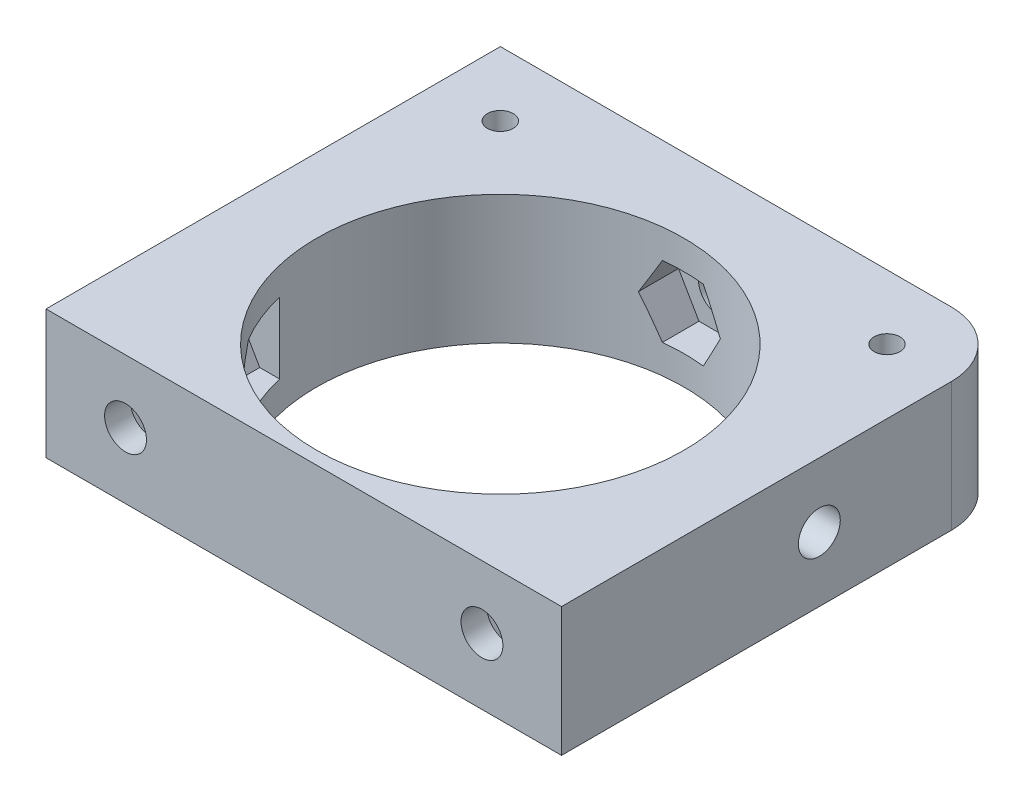
from build123d import *
from build123d.topology import SkipClean

# Parameters (mm, degrees)
CROQUIS1_R                              = 15.25
CROQUIS1_R_2                            = 2.125
SOPORTE_CAJA_REDUCTORA_DEPTH            = 20
CROQUIS3_R                              = 2.125
CORTAR_EXTRUIR1_DEPTH                   = 51.423828692
REDONDEO1_R                             = 5
BOSS_EXTRUDE1_START                     = -20
BOSS_EXTRUDE1_DEPTH                     = 20
CUT_EXTRUDE1_REACH                      = 55.852
SKETCH2_R                               = 1.625
CUT_EXTRUDE2_DEPTH                      = 2
SKETCH4_R                               = 1.625
CUT_EXTRUDE3_DEPTH                      = 63.291652731
CUT_EXTRUDE4_START                      = -4.5
CUT_EXTRUDE4_DEPTH                      = 2
CROQUIS6_W                              = 4.75
CROQUIS6_H                              = 4.75
CORTAR_EXTRUIR17_DEPTH                  = 42.231056256
CROQUIS7_W                              = 60
CROQUIS7_H                              = 20
CORTAR_EXTRUIR18_DEPTH                  = 51.423828692
SALIENTE_EXTRUIR2_DEPTH                 = 49
SOPORTE_START                           = -15
SOPORTE_MOTOR_DEPTH                     = 15
CROQUIS12_R                             = 2.125
AGUJEROS_DE_SUJECION_A_BASE_DEPTH       = 84.087679592
TUERCA_START                            = -4
TUERCA_AGUJERO_DE_SUJECION_A_BASE_DEPTH = 10
SALIENTE_EXTRUIR4_DEPTH                 = 15
CORTAR_EXTRUIR19_DEPTH                  = 25
CROQUIS14_W                             = 50
CROQUIS14_H                             = 118
CORTAR_EXTRUIR22_DEPTH                  = 146.556045907
CROQUIS15_W                             = 10
CROQUIS15_H                             = 7
CORTAR_EXTRUIR23_DEPTH                  = 42.231056256
CORTAR_EXTRUIR24_DEPTH                  = 42.231056256
CROQUIS18_W                             = 40
CROQUIS18_H                             = 10
CORTAR_EXTRUIR25_DEPTH                  = 44.27311521
SALIENTE_EXTRUIR5_DEPTH                 = 10
CROQUIS20_R                             = 1
CORTAR_EXTRUIR26_DEPTH                  = 49.229270158
CORTAR_EXTRUIR27_REACH                  = 62.959
CORTAR_EXTRUIR27_END_RADIUS             = 15.25
CROQUIS21_R                             = 1.625
CROQUIS22_R                             = 2.125
CROQUIS22_R_2                           = 1
SALIENTE_EXTRUIR6_DEPTH                 = 10
CROQUIS23_R                             = 1.625
CORTAR_EXTRUIR28_DEPTH                  = 52.269508521
CORTAR_EXTRUIR29_START                  = -3
CORTAR_EXTRUIR29_DEPTH                  = 10
SALIENTE_EXTRUIR7_DEPTH                 = 10
CORTAR_EXTRUIR30_REACH                  = 72.235
CROQUIS27_R                             = 1.625
CORTAR_EXTRUIR31_REACH                  = 75.235
CORTAR_EXTRUIR31_START                  = -3
CORTAR_EXTRUIR32_REACH                  = 58.612
CROQUIS29_R                             = 1.625
CORTAR_EXTRUIR33_REACH                  = 61.112
CORTAR_EXTRUIR33_START                  = -2.5
CORTAR_EXTRUIR34_DEPTH                  = 63.931555098
CORTAR_EXTRUIR34_DEPTH_BACK             = 63.931555098
CROQUIS35_W                             = 13.305418987
CROQUIS35_H                             = 6.826864192
CORTAR_EXTRUIR35_START                  = -3
CORTAR_EXTRUIR35_DEPTH                  = 10
SALIENTE_EXTRUIR8_DEPTH                 = 10
SALIENTE_EXTRUIR9_DEPTH                 = 13
SALIENTE_EXTRUIR10_DEPTH                = 3
CORTAR_EXTRUIR36_DEPTH                  = 80.887064817
CORTAR_EXTRUIR36_DEPTH_BACK             = 80.887064817
CROQUIS40_W                             = 106.583537839
CROQUIS40_H                             = 47.391515964
CORTAR_EXTRUIR37_DEPTH                  = 67.2524009
CORTAR_EXTRUIR37_DEPTH_BACK             = 67.2524009
CORTAR_EXTRUIR38_DEPTH                  = 79.704784639
CORTAR_EXTRUIR38_DEPTH_BACK             = 79.704784639
SALIENTE_EXTRUIR11_DEPTH                = 10
CORTAR_EXTRUIR39_DEPTH                  = 63.9908649
CROQUIS45_W                             = 31.470301378
CROQUIS45_H                             = 10
CROQUIS45_R                             = 1.625
SALIENTE_EXTRUIR12_DEPTH                = 2.5
SALIENTE_EXTRUIR13_DEPTH                = 10
CORTAR_EXTRUIR40_START                  = -2
CROQUIS47_R                             = 1.625
CORTAR_EXTRUIR40_DEPTH                  = 10
CORTAR_EXTRUIR41_START                  = -12
CROQUIS48_R                             = 1.625
CORTAR_EXTRUIR41_DEPTH                  = 12
CORTAR_EXTRUIR42_DEPTH                  = 52.795622989
CORTAR_EXTRUIR42_DEPTH_BACK             = 52.795622989
CROQUIS49_W                             = 34.796066513
CROQUIS49_H                             = 42.211026982
CROQUIS51_R                             = 15.25
CROQUIS51_R_2                           = 14.25
SALIENTE_EXTRUIR14_DEPTH                = 10
CORTAR_EXTRUIR43_DEPTH                  = 10
CORTAR_EXTRUIR44_DEPTH                  = 10
CORTAR_EXTRUIR45_DEPTH                  = 10
SALIENTE_EXTRUIR15_DEPTH                = 10


with BuildPart() as part:
    # Croquis1 → Soporte caja reductora (new body)
    with BuildSketch(Plane(origin=(0, 0, 0), x_dir=(1, 0, 0), z_dir=(0, 1, 0))):
        Polygon((-30, -15.25), (-20, -15.25), (-20, -20), (20, -20), (20, -15.25), (30, -15.25), (30, -7.25), (20, -4.25), (20, 20), (-20, 20), (-20, -4.25), (-30, -7.25), align=None)
        with Locations(Location((0, 0, 0), (0, 0, 270))):
            Circle(CROQUIS1_R, mode=Mode.SUBTRACT)
        with Locations(Location((-15, 15, 0), (0, 0, 270))):
            Circle(CROQUIS1_R_2, mode=Mode.SUBTRACT)
        with Locations(Location((15, 15, 0), (0, 0, 270))):
            Circle(CROQUIS1_R_2, mode=Mode.SUBTRACT)
    extrude(amount=-SOPORTE_CAJA_REDUCTORA_DEPTH)

    # Croquis3 → Cortar-Extruir1 (cut, through all)
    with BuildSketch(Plane.XY.offset(15.25)):
        with Locations((-23.5, -10)):
            Circle(CROQUIS3_R)
        with Locations((23.5, -10)):
            Circle(CROQUIS3_R)
    extrude(amount=-CORTAR_EXTRUIR1_DEPTH, mode=Mode.SUBTRACT)

    # Redondeo1
    redondeo1_edges = [part.edges().sort_by_distance(p)[0] for p in [
        (-20, -10, -20),
        (20, -10, -20),
    ]]
    fillet(redondeo1_edges, radius=REDONDEO1_R)

    # Sketch1 → Boss-Extrude1 (add)
    with BuildSketch(Plane(origin=(0, 0, 0), x_dir=(1, 0, 0), z_dir=(0, 1, 0)).offset(BOSS_EXTRUDE1_START)):
        with BuildLine():
            Line((25.5, 15), (20, 15))
            ThreePointArc((20, 15), (18.535533906, 18.535533906), (15, 20))
            Line((15, 20), (30, 20))
            Line((30, 20), (30, 8))
            Line((30, 8), (25.5, 8))
            Line((25.5, 8), (25.5, 15))
        make_face()
    extrude(amount=BOSS_EXTRUDE1_DEPTH)

    # Sketch2 → Cut-Extrude1 (cut, up to next)
    with BuildSketch(Plane(origin=(0, 0, -20), x_dir=(-1, 0, 0), z_dir=(0, 0, -1)), mode=Mode.PRIVATE) as cut_extrude1_sk1:
        with Locations((-22.75, -10)):
            Circle(SKETCH2_R)
    cut_extrude1_tool1 = extrude(cut_extrude1_sk1.sketch, amount=-CUT_EXTRUDE1_REACH, mode=Mode.PRIVATE) & part.part
    add(cut_extrude1_tool1.solids().sort_by_distance((22.75, -10, -20))[0], mode=Mode.SUBTRACT)

    # Sketch3 → Cut-Extrude2 (cut)
    with BuildSketch(Plane.XY.offset(-15)):
        Polygon((20, -11.58771324), (22.75, -13.175426481), (25.5, -11.58771324), (25.5, -8.41228676), (22.75, -6.824573519), (20, -8.41228676), align=None)
    extrude(amount=-CUT_EXTRUDE2_DEPTH, mode=Mode.SUBTRACT)

    # Sketch4 → Cut-Extrude3 (cut, through all)
    with BuildSketch(Plane.ZY.offset(-25.5)):
        with Locations((-12.25, -10)):
            Circle(SKETCH4_R)
    extrude(amount=-CUT_EXTRUDE3_DEPTH, mode=Mode.SUBTRACT)

    # Sketch5 → Cut-Extrude4 (cut)
    with BuildSketch(Plane(origin=(30, 0, 0), x_dir=(0, 0, -1), z_dir=(1, 0, 0)).offset(CUT_EXTRUDE4_START)):
        Polygon((15, -11.58771324), (15, -8.41228676), (12.25, -6.824573519), (9.5, -8.41228676), (9.5, -11.58771324), (12.25, -13.175426481), align=None)
    extrude(amount=CUT_EXTRUDE4_DEPTH, mode=Mode.SUBTRACT)

    # Croquis6 → Cortar-Extruir17 (cut, through all)
    with BuildSketch(Plane(origin=(0, 0, 0), x_dir=(1, 0, 0), z_dir=(0, 1, 0))):
        Polygon((0, -15.25), (-15.25, -15.25), (-15.25, -20), (15.25, -20), (15.25, -15.25), align=None)
        with Locations((-17.625, -17.625)):
            Rectangle(CROQUIS6_W, CROQUIS6_H)
        with BuildLine():
            ThreePointArc((0, -15.25), (-10.783378413, -10.783378413), (-15.25, 0))
            Line((-15.25, 0), (-15.25, -15.25))
            Line((-15.25, -15.25), (0, -15.25))
        make_face()
        with BuildLine():
            Line((15.25, -15.25), (15.25, 0))
            ThreePointArc((15.25, 0), (10.783378413, -10.783378413), (0, -15.25))
            Line((0, -15.25), (15.25, -15.25))
        make_face()
        with Locations((17.625, -17.625)):
            Rectangle(CROQUIS6_W, CROQUIS6_H)
    extrude(amount=-CORTAR_EXTRUIR17_DEPTH, mode=Mode.SUBTRACT)


with BuildPart() as body_2:
    # Simetría1: mirrored copy
    add(part.part.mirror(Plane.ZX))

    # Croquis8 → Saliente-Extruir2 (add)
    with SkipClean():  # the faces are left unmerged after this step: merging them gives an invalid solid
        with BuildSketch(Plane(origin=(0, 20, 0), x_dir=(1, 0, 0), z_dir=(0, 1, 0))):
            with BuildLine():
                Line((-12.664515522, 20), (-11.040489496, 13.939052358))
                Line((-11.040489496, 13.939052358), (-10.315162126, 11.232093763))
                ThreePointArc((-10.315162126, 11.232093763), (0, 15.25), (10.315162126, 11.232093763))
                Line((10.315162126, 11.232093763), (10.817418481, 13.87928066))
                Line((10.817418481, 13.87928066), (11.978715476, 20))
                Line((11.978715476, 20), (-12.664515522, 20))
            make_face()
        extrude(amount=SALIENTE_EXTRUIR2_DEPTH)

    # Croquis9 → Soporte motor (add)
    with SkipClean():  # the faces are left unmerged after this step: merging them gives an invalid solid
        with BuildSketch(Plane(origin=(0, 69, 0), x_dir=(1, 0, 0), z_dir=(0, 1, 0)).offset(SOPORTE_START)):
            with BuildLine():
                Line((-20, 15), (-20, -4.25))
                Line((-20, -4.25), (-30, -7.25))
                Line((-30, -7.25), (-30, -15.25))
                Line((-30, -15.25), (0, -15.25))
                Line((0, -15.25), (0, -14.75))
                ThreePointArc((0, -14.75), (-10.429825023, 10.429825023), (14.75, 0))
                Line((14.75, 0), (20, 0))
                Line((20, 0), (20, 13.936837101))
                Line((20, 13.936837101), (12.664515522, 20))
                Line((12.664515522, 20), (-15, 20))
                ThreePointArc((-15, 20), (-18.535533906, 18.535533906), (-20, 15))
            make_face()
        extrude(amount=-SOPORTE_MOTOR_DEPTH)

    # Croquis12 → Agujeros de sujecion a base (cut, through all)
    with SkipClean():  # the faces are left unmerged after this step: merging them gives an invalid solid
        with BuildSketch(Plane.XY.offset(15.25)):
            with Locations((-23.5, 46.5)):
                Circle(CROQUIS12_R)
        extrude(amount=-AGUJEROS_DE_SUJECION_A_BASE_DEPTH, mode=Mode.SUBTRACT)

    # Croquis13 → Tuerca Agujero de sujecion a base (cut)
    with SkipClean():  # the faces are left unmerged after this step: merging them gives an invalid solid
        with BuildSketch(Plane.XY.offset(15.25).offset(TUERCA_START)):
            Polygon((-20, 44.479274058), (-20, 48.520725942), (-23.5, 50.541451884), (-27, 48.520725942), (-27, 44.479274058), (-23.5, 42.458548116), align=None)
        extrude(amount=-TUERCA_AGUJERO_DE_SUJECION_A_BASE_DEPTH, mode=Mode.SUBTRACT)

    # Croquis10 → Saliente-Extruir4 (add)
    with SkipClean():  # the faces are left unmerged after this step: merging them gives an invalid solid
        with BuildSketch(Plane(origin=(0, 69, 0), x_dir=(1, 0, 0), z_dir=(0, 1, 0))):
            with BuildLine():
                ThreePointArc((10.315162126, 11.232093763), (0, 15.25), (-10.315162126, 11.232093763))
                Line((-10.315162126, 11.232093763), (-10.16850369, 10.684757026))
                ThreePointArc((-10.16850369, 10.684757026), (0, 14.75), (10.16850369, 10.684757026))
                Line((10.16850369, 10.684757026), (10.315162126, 11.232093763))
            make_face()
        extrude(amount=-SALIENTE_EXTRUIR4_DEPTH)

    # Croquis11 → Cortar-Extruir19 (cut)
    with SkipClean():  # the faces are left unmerged after this step: merging them gives an invalid solid
        with BuildSketch(Plane.XZ):
            with BuildLine():
                Line((15.25, 4.25), (20, 4.25))
                Line((20, 4.25), (21.972856468, 4.84185694))
                ThreePointArc((21.972856468, 4.84185694), (19.948931102, 10.40625523), (16.543503257, 15.25))
                Line((16.543503257, 15.25), (15.25, 15.25))
                Line((15.25, 15.25), (15.25, 4.25))
            make_face()
            with BuildLine():
                Line((21.972856468, 4.84185694), (30, 7.25))
                Line((30, 7.25), (30, 15.25))
                Line((30, 15.25), (16.543503257, 15.25))
                ThreePointArc((16.543503257, 15.25), (19.948931102, 10.40625523), (21.972856468, 4.84185694))
            make_face()
            with BuildLine():
                ThreePointArc((20, -15), (18.535533906, -18.535533906), (15, -20))
                Line((15, -20), (30, -20))
                Line((30, -20), (30, -8))
                Line((30, -8), (25.5, -8))
                Line((25.5, -8), (25.5, -15))
                Line((25.5, -15), (20, -15))
            make_face()
        extrude(amount=-CORTAR_EXTRUIR19_DEPTH, mode=Mode.SUBTRACT)

    # Simetría2: body 2 across face


with BuildPart() as part_1:
    add(part.part)

    # Croquis7 → Cortar-Extruir18 (cut, through all)
    with BuildSketch(Plane(origin=(0, 0, -20), x_dir=(-1, 0, 0), z_dir=(0, 0, -1))):
        with Locations((0, -10)):
            Rectangle(CROQUIS7_W, CROQUIS7_H)
    extrude(amount=-CORTAR_EXTRUIR18_DEPTH, mode=Mode.SUBTRACT)


with BuildPart() as body_2_1:
    with SkipClean():  # the faces are left unmerged after this step: merging them gives an invalid solid
        add(body_2.part)
        add(body_2.part.mirror(Plane(origin=(-0.247462117, 69, -16.905803936), x_dir=(0, 0, 1), z_dir=(0, 1, 0))))

    # Croquis14 → Cortar-Extruir22 (cut, through all)
    with BuildSketch(Plane.XY.offset(15.25)):
        with Locations((-5, 79)):
            Rectangle(CROQUIS14_W, CROQUIS14_H)
    extrude(amount=-CORTAR_EXTRUIR22_DEPTH, mode=Mode.SUBTRACT)

    # Croquis15 → Cortar-Extruir23 (cut, through all)
    with BuildSketch(Plane.XZ):
        with Locations((-25, 7.75)):
            Rectangle(CROQUIS15_W, CROQUIS15_H)
    extrude(amount=-CORTAR_EXTRUIR23_DEPTH, mode=Mode.SUBTRACT)

    # Croquis16 → Cortar-Extruir24 (cut, through all)
    with BuildSketch(Plane.XZ):
        Polygon((-30, 15.25), (-15.25, 15.25), (-15.25, 12.75), (-20, 12.75), (-20, 11.25), (-30, 11.25), (-30, 12.75), align=None)
    extrude(amount=-CORTAR_EXTRUIR24_DEPTH, mode=Mode.SUBTRACT)

    # Croquis18 → Cortar-Extruir25 (cut, through all)
    with BuildSketch(Plane(origin=(0, 0, -20), x_dir=(-1, 0, 0), z_dir=(0, 0, -1))):
        with Locations((0, 5)):
            Rectangle(CROQUIS18_W, CROQUIS18_H)
    extrude(amount=-CORTAR_EXTRUIR25_DEPTH, mode=Mode.SUBTRACT)

    # Croquis19 → Saliente-Extruir5 (add)
    with BuildSketch(Plane(origin=(0, 20, 0), x_dir=(1, 0, 0), z_dir=(0, 1, 0))):
        Polygon((-20, -12.75), (-34, -12.75), (-34, -7.75), (-24, -7.75), (-20, -3.75), align=None)
    extrude(amount=-SALIENTE_EXTRUIR5_DEPTH)

    # Croquis20 → Cortar-Extruir26 (cut, through all)
    with BuildSketch(Plane(origin=(0, 0, 7.75), x_dir=(-1, 0, 0), z_dir=(0, 0, -1))):
        with Locations((29, 15)):
            Circle(CROQUIS20_R)
    extrude(amount=-CORTAR_EXTRUIR26_DEPTH, mode=Mode.SUBTRACT)

    # Cortar-Extruir27: up to this cylinder (the profile starts outside it)
    cortar_extruir27_end = Plane(origin=(0, 15, 0), z_dir=(0, -1, 0)) * Cylinder(CORTAR_EXTRUIR27_END_RADIUS, 157.418, mode=Mode.PRIVATE)
    # Croquis21 → Cortar-Extruir27 (cut, up to the surface)
    with BuildSketch(Plane(origin=(20, 0, 0), x_dir=(0, 0, -1), z_dir=(1, 0, 0)), mode=Mode.PRIVATE) as cortar_extruir27_sk1:
        with Locations((4.75, 15)):
            Circle(CROQUIS21_R)
    cortar_extruir27_tool1 = extrude(cortar_extruir27_sk1.sketch, amount=-CORTAR_EXTRUIR27_REACH, mode=Mode.PRIVATE) - cortar_extruir27_end
    add(cortar_extruir27_tool1.solids().sort_by_distance((20, 15, -4.75))[0], mode=Mode.SUBTRACT)

    # Croquis22 → Saliente-Extruir6 (add)
    # profile 1 of 2: a face of its own
    with BuildSketch(Plane.XZ.offset(-10)):
        with Locations((-15, -15)):
            Circle(CROQUIS22_R)
        with Locations(Location((-15, -15, 0), (0, 0, 270))):
            Circle(CROQUIS22_R_2, mode=Mode.SUBTRACT)
    # profile 2 of 2: a face of its own
    with BuildSketch(Plane.XZ.offset(-10)):
        with Locations((15, -15)):
            Circle(CROQUIS22_R)
        with Locations(Location((15, -15, 0), (0, 0, 270))):
            Circle(CROQUIS22_R_2, mode=Mode.SUBTRACT)
    extrude(amount=-SALIENTE_EXTRUIR6_DEPTH)

    # Croquis23 → Cortar-Extruir28 (cut, through all)
    with BuildSketch(Plane(origin=(0, 0, -20), x_dir=(-1, 0, 0), z_dir=(0, 0, -1))):
        with Locations((0, 15)):
            Circle(CROQUIS23_R)
    extrude(amount=-CORTAR_EXTRUIR28_DEPTH, mode=Mode.SUBTRACT)

    # Croquis24 → Cortar-Extruir29 (cut)
    with BuildSketch(Plane(origin=(0, 0, -20), x_dir=(-1, 0, 0), z_dir=(0, 0, -1)).offset(CORTAR_EXTRUIR29_START)):
        Polygon((1.58771324, 12.25), (3.175426481, 15), (1.58771324, 17.75), (-1.58771324, 17.75), (-3.175426481, 15), (-1.58771324, 12.25), align=None)
    extrude(amount=-CORTAR_EXTRUIR29_DEPTH, mode=Mode.SUBTRACT)

    # Croquis26 → Saliente-Extruir7 (add)
    with BuildSketch(Plane.XZ.offset(-10)):
        Polygon((-34, 7.75), (-34, 12.75), (-58.825, 12.75), (-39.160527763, -4.104491148), (-20, -4.104491148), (-20, -0.104491148), (-35.732113118, -0.104491148), (-29, 7.75), align=None)
        Polygon((-34.268209086, 7.75), (-39.594516123, 1.535690951), (-46.844874897, 7.75), align=None, mode=Mode.SUBTRACT)
    extrude(amount=-SALIENTE_EXTRUIR7_DEPTH)

    # Croquis27 → Cortar-Extruir30 (cut, up to next)
    with BuildSketch(Plane.XY.offset(12.75), mode=Mode.PRIVATE) as cortar_extruir30_sk1:
        with Locations((-40.544874897, 15)):
            Circle(CROQUIS27_R)
    cortar_extruir30_tool1 = extrude(cortar_extruir30_sk1.sketch, amount=-CORTAR_EXTRUIR30_REACH, mode=Mode.PRIVATE) & body_2_1.part
    # Croquis27 → Cortar-Extruir30 (cut, up to next)
    with BuildSketch(Plane.XY.offset(12.75), mode=Mode.PRIVATE) as cortar_extruir30_sk2:
        with Locations((-29, 15)):
            Circle(CROQUIS27_R)
    cortar_extruir30_tool2 = extrude(cortar_extruir30_sk2.sketch, amount=-CORTAR_EXTRUIR30_REACH, mode=Mode.PRIVATE) & body_2_1.part
    add(cortar_extruir30_tool1.solids().sort_by_distance((-40.544875, 15, 12.75))[0], mode=Mode.SUBTRACT)
    add(cortar_extruir30_tool2.solids().sort_by_distance((-29, 15, 12.75))[0], mode=Mode.SUBTRACT)

    # Croquis28 → Cortar-Extruir31 (cut, up to next)
    with BuildSketch(Plane.XY.offset(12.75).offset(CORTAR_EXTRUIR31_START), mode=Mode.PRIVATE) as cortar_extruir31_sk1:
        Polygon((-38.957161657, 12.25), (-37.369448416, 15), (-38.957161657, 17.75), (-42.132588137, 17.75), (-43.720301378, 15), (-42.132588137, 12.25), align=None)
    cortar_extruir31_tool1 = extrude(cortar_extruir31_sk1.sketch, amount=-CORTAR_EXTRUIR31_REACH, mode=Mode.PRIVATE) & body_2_1.part
    # Croquis28 → Cortar-Extruir31 (cut, up to next)
    with BuildSketch(Plane.XY.offset(12.75).offset(CORTAR_EXTRUIR31_START), mode=Mode.PRIVATE) as cortar_extruir31_sk2:
        Polygon((-27.41228676, 12.25), (-25.824573519, 15), (-27.41228676, 17.75), (-30.58771324, 17.75), (-32.175426481, 15), (-30.58771324, 12.25), align=None)
    cortar_extruir31_tool2 = extrude(cortar_extruir31_sk2.sketch, amount=-CORTAR_EXTRUIR31_REACH, mode=Mode.PRIVATE) & body_2_1.part
    add(cortar_extruir31_tool1.solids().sort_by_distance((-40.544875, 15, 9.75))[0], mode=Mode.SUBTRACT)
    add(cortar_extruir31_tool2.solids().sort_by_distance((-29, 15, 9.75))[0], mode=Mode.SUBTRACT)

    # Croquis29 → Cortar-Extruir32 (cut, up to next)
    with BuildSketch(Plane(origin=(-18.612848159, 0, -21.715982563), x_dir=(-0.7592713073348843, 0, 0.6507742172658468), z_dir=(-0.6507742172658468, 0, -0.7592713073348843)), mode=Mode.PRIVATE) as cortar_extruir32_sk1:
        with Locations((33.812368097, 15)):
            Circle(CROQUIS29_R)
    cortar_extruir32_tool1 = extrude(cortar_extruir32_sk1.sketch, amount=-CORTAR_EXTRUIR32_REACH, mode=Mode.PRIVATE) & body_2_1.part
    add(cortar_extruir32_tool1.solids().sort_by_distance((-44.285609, 15, 0.288235))[0], mode=Mode.SUBTRACT)

    # Croquis31 → Cortar-Extruir33 (cut, up to next)
    with BuildSketch(Plane(origin=(-18.612848159, 0, -21.715982563), x_dir=(-0.7592713073348843, 0, 0.6507742172658468), z_dir=(-0.6507742172658468, 0, -0.7592713073348843)).offset(CORTAR_EXTRUIR33_START), mode=Mode.PRIVATE) as cortar_extruir33_sk1:
        Polygon((36.562368097, 16.58771324), (33.812368097, 18.175426481), (31.062368097, 16.58771324), (31.062368097, 13.41228676), (33.812368097, 11.824573519), (36.562368097, 13.41228676), align=None)
    cortar_extruir33_tool1 = extrude(cortar_extruir33_sk1.sketch, amount=-CORTAR_EXTRUIR33_REACH, mode=Mode.PRIVATE) & body_2_1.part
    add(cortar_extruir33_tool1.solids().sort_by_distance((-42.658674, 15, 2.186413))[0], mode=Mode.SUBTRACT)

    # Croquis35 → Cortar-Extruir34 (cut, two sides: drawn at the far end of the back side and taken through both)
    with BuildSketch(Plane(origin=(0, 20, 0), x_dir=(1, 0, 0), z_dir=(0, 1, 0)).offset(-CORTAR_EXTRUIR34_DEPTH_BACK)):
        with Locations((17.04227466, -3.413432096)):
            Rectangle(CROQUIS35_W, CROQUIS35_H)
    extrude(amount=CORTAR_EXTRUIR34_DEPTH + CORTAR_EXTRUIR34_DEPTH_BACK, mode=Mode.SUBTRACT)

    # Croquis36 → Cortar-Extruir35 (cut)
    with BuildSketch(Plane(origin=(20, 0, 0), x_dir=(0, 0, -1), z_dir=(1, 0, 0)).offset(CORTAR_EXTRUIR35_START)):
        Polygon((7.5, 16.58771324), (4.75, 18.175426481), (2, 16.58771324), (2, 13.41228676), (4.75, 11.824573519), (7.5, 13.41228676), align=None)
    extrude(amount=-CORTAR_EXTRUIR35_DEPTH, mode=Mode.SUBTRACT)

    # Croquis37 → Saliente-Extruir8 (add)
    with BuildSketch(Plane.XZ.offset(-10)):
        Polygon((-39.160527763, -4.104491148), (-20.614919368, -20), (-15, -20), (-19.558128305, -15.637570403), (-33.014002756, -4.104491148), align=None)
    extrude(amount=-SALIENTE_EXTRUIR8_DEPTH)

    # Croquis38 → Saliente-Extruir9 (add)
    with BuildSketch(Plane.XZ.offset(-10)):
        Polygon((-58.825, 12.75), (-38.825, 12.75), (-38.825, 9.75), (-55.324839942, 9.75), align=None)
    extrude(amount=SALIENTE_EXTRUIR9_DEPTH)

    # Croquis39 → Saliente-Extruir10 (add)
    with BuildSketch(Plane.XZ.offset(-10)):
        Polygon((-38.825, 9.75), (-38.825, 7.75), (-38.825, 5.75), (-50.657959865, 5.75), (-52.991399903, 7.75), (-55.324839942, 9.75), align=None)
    extrude(amount=SALIENTE_EXTRUIR10_DEPTH)

    # Simetría3: body 2 across face


with BuildPart() as body_2_2:
    add(body_2_1.part)
    add(body_2_1.part.mirror(Plane(origin=(-18.003999227, 20, -4.220503046), x_dir=(0, 0, 1), z_dir=(0, 1, 0))))

    # Croquis40 → Cortar-Extruir36 (cut, two sides: drawn at the far end of the back side and taken through both)
    with BuildSketch(Plane(origin=(0, 0, -20), x_dir=(-1, 0, 0), z_dir=(0, 0, -1)).offset(-CORTAR_EXTRUIR36_DEPTH_BACK)):
        with Locations((22.395502026, -3.695757982)):
            Rectangle(CROQUIS40_W, CROQUIS40_H)
    extrude(amount=CORTAR_EXTRUIR36_DEPTH + CORTAR_EXTRUIR36_DEPTH_BACK, mode=Mode.SUBTRACT)

    # Croquis41 → Cortar-Extruir37 (cut, two sides: drawn at the far end of the back side and taken through both)
    with BuildSketch(Plane.XZ.offset(-20).offset(-CORTAR_EXTRUIR37_DEPTH_BACK)):
        Polygon((-19.992980133, -22.302484261), (-20, 3.75), (-24, 7.75), (-56.035110209, 7.75), align=None)
    extrude(amount=CORTAR_EXTRUIR37_DEPTH + CORTAR_EXTRUIR37_DEPTH_BACK, mode=Mode.SUBTRACT)

    # Croquis42 → Cortar-Extruir38 (cut, two sides: drawn at the far end of the back side and taken through both)
    with BuildSketch(Plane(origin=(0, 0, 9.75), x_dir=(-1, 0, 0), z_dir=(0, 0, -1)).offset(-CORTAR_EXTRUIR38_DEPTH_BACK)):
        Polygon((46.720301378, 20), (46.720301378, 30), (38.825, 30), (33.492952769, 43.760628779), (49.525340398, 48.951442806), (67.200390695, 42.512205152), (65.906601328, 20), (51.713995885, 13.864168239), align=None)
    extrude(amount=CORTAR_EXTRUIR38_DEPTH + CORTAR_EXTRUIR38_DEPTH_BACK, mode=Mode.SUBTRACT)

    # Croquis43 → Saliente-Extruir11 (add)
    with BuildSketch(Plane.XZ.offset(-20)):
        Polygon((-19.993600539, -20), (-46.720301378, 7.75), (-43.839252857, 10.524807997), (-17.112552018, -17.225192003), align=None)
    extrude(amount=-SALIENTE_EXTRUIR11_DEPTH)

    # Croquis44 → Cortar-Extruir39 (cut, through all)
    with BuildSketch(Plane(origin=(0, 0, 9.75), x_dir=(-1, 0, 0), z_dir=(0, 0, -1))):
        Polygon((38.957161657, 27.75), (37.369448416, 25), (38.957161657, 22.25), (42.132588137, 22.25), (43.720301378, 25), (42.132588137, 27.75), align=None)
    extrude(amount=CORTAR_EXTRUIR39_DEPTH, mode=Mode.SUBTRACT)

    # Croquis45 → Saliente-Extruir12 (add)
    with BuildSketch(Plane.XY.offset(12.75)):
        with Locations((-30.985150689, 25)):
            Rectangle(CROQUIS45_W, CROQUIS45_H)
        with Locations((-40.544874897, 25)):
            Circle(CROQUIS45_R, mode=Mode.SUBTRACT)
        with Locations((-29, 25)):
            Circle(CROQUIS45_R, mode=Mode.SUBTRACT)
    extrude(amount=SALIENTE_EXTRUIR12_DEPTH)

    # Croquis46 → Saliente-Extruir13 (add)
    with BuildSketch(Plane.XZ.offset(-20)):
        with BuildLine():
            Line((15.25, 0), (20, 0))
            Line((20, 0), (20, 15.25))
            Line((20, 15.25), (7.549834435, 15.25))
            Line((7.549834435, 15.25), (7.549834435, 13.25))
            ThreePointArc((7.549834435, 13.25), (13.185171124, 7.662490615), (15.25, 0))
        make_face()
        with BuildLine():
            Line((-15.25, 0), (-15.25, 15.25))
            Line((-15.25, 15.25), (-7.549834435, 15.25))
            Line((-7.549834435, 15.25), (-7.549834435, 13.25))
            ThreePointArc((-7.549834435, 13.25), (-13.185171124, 7.662490615), (-15.25, 0))
        make_face()
    extrude(amount=-SALIENTE_EXTRUIR13_DEPTH)

    # Croquis47 → Cortar-Extruir40 (cut)
    # profile 1 of 2: a face of its own
    with BuildSketch(Plane.XY.offset(15.25).offset(CORTAR_EXTRUIR40_START)):
        Polygon((15.41228676, 22.352505966), (17, 25.102505966), (15.41228676, 27.852505966), (12.236860279, 27.852505966), (10.649147039, 25.102505966), (12.236860279, 22.352505966), align=None)
        with Locations((13.824573519, 25.102505966)):
            Circle(CROQUIS47_R, mode=Mode.SUBTRACT)
    # profile 2 of 2: a face of its own
    with BuildSketch(Plane.XY.offset(15.25).offset(CORTAR_EXTRUIR40_START)):
        Polygon((-12.236860279, 22.352505966), (-15.41228676, 22.352505966), (-17, 25.102505966), (-15.41228676, 27.852505966), (-12.236860279, 27.852505966), (-10.649147039, 25.102505966), align=None)
        with Locations(Location((-13.824573519, 25.102505966, 0), (0, 0, 131.421584744))):
            Circle(CROQUIS47_R, mode=Mode.SUBTRACT)
    extrude(amount=-CORTAR_EXTRUIR40_DEPTH, mode=Mode.SUBTRACT)

    # Croquis48 → Cortar-Extruir41 (cut)
    with BuildSketch(Plane.XY.offset(15.25).offset(CORTAR_EXTRUIR41_START)):
        with Locations((13.824573519, 25.102505966)):
            Circle(CROQUIS48_R)
        with Locations((-13.824573519, 25.102505966)):
            Circle(CROQUIS48_R)
    extrude(amount=CORTAR_EXTRUIR41_DEPTH, mode=Mode.SUBTRACT)

    # Croquis49 → Cortar-Extruir42 (cut, two sides: drawn at the far end of the back side and taken through both)
    with BuildSketch(Plane.XZ.offset(-20).offset(-CORTAR_EXTRUIR42_DEPTH_BACK)):
        with Locations((-37.391633796, 1.105513491)):
            Rectangle(CROQUIS49_W, CROQUIS49_H)
    extrude(amount=CORTAR_EXTRUIR42_DEPTH + CORTAR_EXTRUIR42_DEPTH_BACK, mode=Mode.SUBTRACT)

    # Croquis51 → Saliente-Extruir14 (add)
    with BuildSketch(Plane(origin=(0, 30, 0), x_dir=(1, 0, 0), z_dir=(0, 1, 0))):
        Circle(CROQUIS51_R)
        with Locations(Location((0, 0, 0), (0, 0, 270))):
            Circle(CROQUIS51_R_2, mode=Mode.SUBTRACT)
    extrude(amount=-SALIENTE_EXTRUIR14_DEPTH)

    # Croquis52 → Cortar-Extruir43 (cut)
    with BuildSketch(Plane(origin=(0, 0, 13.25), x_dir=(-1, 0, 0), z_dir=(0, 0, -1))):
        Polygon((-10.649147039, 25.102505966), (-12.236860279, 27.852505966), (-15.41228676, 27.852505966), (-17, 25.102505966), (-15.41228676, 22.352505966), (-12.236860279, 22.352505966), align=None)
        Polygon((17, 25.102505966), (15.41228676, 27.852505966), (12.236860279, 27.852505966), (10.649147039, 25.102505966), (12.236860279, 22.352505966), (15.41228676, 22.352505966), align=None)
    extrude(amount=CORTAR_EXTRUIR43_DEPTH, mode=Mode.SUBTRACT)

    # Croquis53 → Cortar-Extruir44 (cut)
    with BuildSketch(Plane.XY.offset(-17)):
        Polygon((3.175426481, 25), (1.58771324, 27.75), (-1.58771324, 27.75), (-3.175426481, 25), (-1.58771324, 22.25), (1.58771324, 22.25), align=None)
    extrude(amount=CORTAR_EXTRUIR44_DEPTH, mode=Mode.SUBTRACT)

    # Croquis54 → Cortar-Extruir45 (cut)
    with BuildSketch(Plane.ZY.offset(-17)):
        Polygon((-4.75, 28.175426481), (-7.5, 26.58771324), (-7.5, 23.41228676), (-4.75, 21.824573519), (-2, 23.41228676), (-2, 26.58771324), align=None)
    extrude(amount=CORTAR_EXTRUIR45_DEPTH, mode=Mode.SUBTRACT)

    # Croquis55 → Saliente-Extruir15 (add)
    with BuildSketch(Plane(origin=(0, 30, 0), x_dir=(1, 0, 0), z_dir=(0, 1, 0))):
        with BuildLine():
            Line((-7.549834435, -13.25), (-7.549834435, -15.25))
            Line((-7.549834435, -15.25), (0, -15.25))
            ThreePointArc((0, -15.25), (-3.905124838, -14.741522988), (-7.549834435, -13.25))
        make_face()
        with BuildLine():
            ThreePointArc((7.549834435, -13.25), (3.905124838, -14.741522988), (0, -15.25))
            Line((0, -15.25), (7.549834435, -15.25))
            Line((7.549834435, -15.25), (7.549834435, -13.25))
        make_face()
    extrude(amount=-SALIENTE_EXTRUIR15_DEPTH)


solid = body_2_2.part
